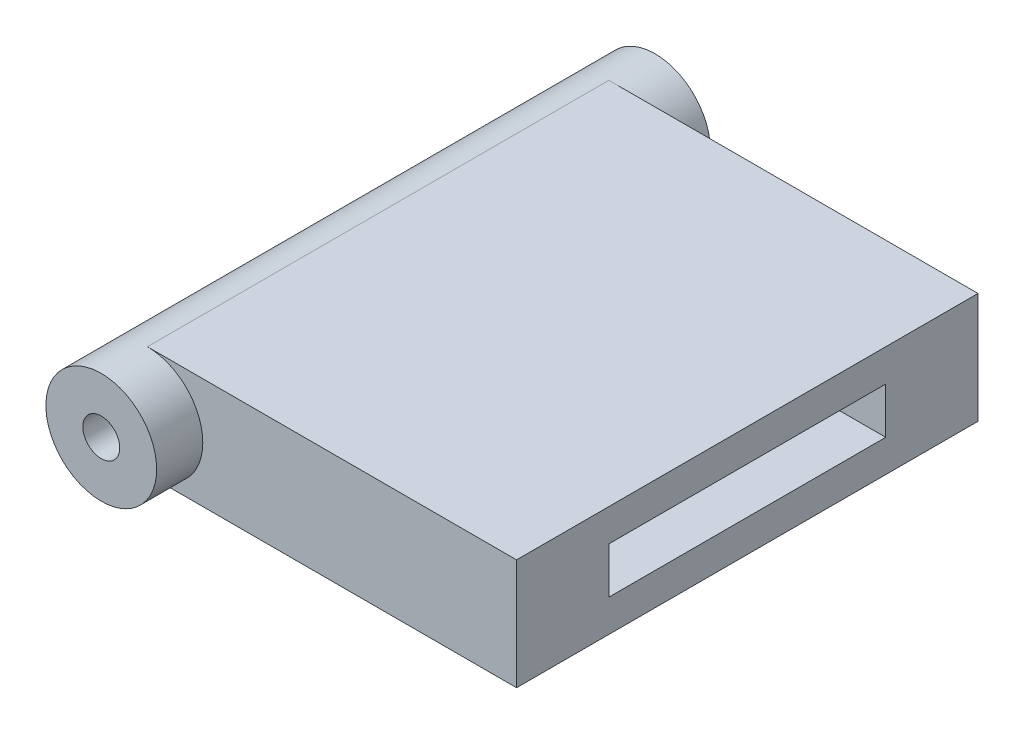
from build123d import *

# Parameters (mm, degrees)
SKETCH4_R               = 7.62
SKETCH4_R_2             = 2.54
BOSS_EXTRUDE1_DEPTH     = 76.2
SKETCH5_W               = 63.5
SKETCH5_H               = 15.24
BOSS_EXTRUDE2_DEPTH     = 50.8
SKETCH6_W               = 38.1
SKETCH6_H               = 6.35
CUT_EXTRUDE1_DEPTH      = 25.4
CUT_EXTRUDE2_DEPTH      = 92.897466777
CUT_EXTRUDE2_DEPTH_BACK = 92.897466777
SKETCH7_R               = 2.54


with BuildPart() as part:
    # Sketch4 → Boss-Extrude1 (new body)
    with BuildSketch(Plane.XY):
        with Locations(Location((0, 0, 0), (0, 0, 180))):
            Circle(SKETCH4_R)
        with Locations(Location((0, 0, 0), (0, 0, 180))):
            Circle(SKETCH4_R_2, mode=Mode.SUBTRACT)
    extrude(amount=BOSS_EXTRUDE1_DEPTH)

    # Sketch5 → Boss-Extrude2 (add)
    with BuildSketch(Plane(origin=(0, 0, 0), x_dir=(0, 0, -1), z_dir=(1, 0, 0))):
        with Locations((-38.1, 0)):
            Rectangle(SKETCH5_W, SKETCH5_H)
    extrude(amount=BOSS_EXTRUDE2_DEPTH)

    # Sketch6 → Cut-Extrude1 (cut)
    with BuildSketch(Plane(origin=(50.8, 0, 0), x_dir=(0, 0, -1), z_dir=(1, 0, 0))):
        with Locations((-38.1, 0)):
            Rectangle(SKETCH6_W, SKETCH6_H)
    extrude(amount=-CUT_EXTRUDE1_DEPTH, mode=Mode.SUBTRACT)

    # Sketch7 → Cut-Extrude2 (cut, two sides: drawn at the far end of the back side and taken through both)
    with BuildSketch(Plane.XY.offset(-CUT_EXTRUDE2_DEPTH_BACK)):
        with Locations(Location((0, 0, 0), (0, 0, 180))):
            Circle(SKETCH7_R)
    extrude(amount=CUT_EXTRUDE2_DEPTH + CUT_EXTRUDE2_DEPTH_BACK, mode=Mode.SUBTRACT)


solid = part.part
